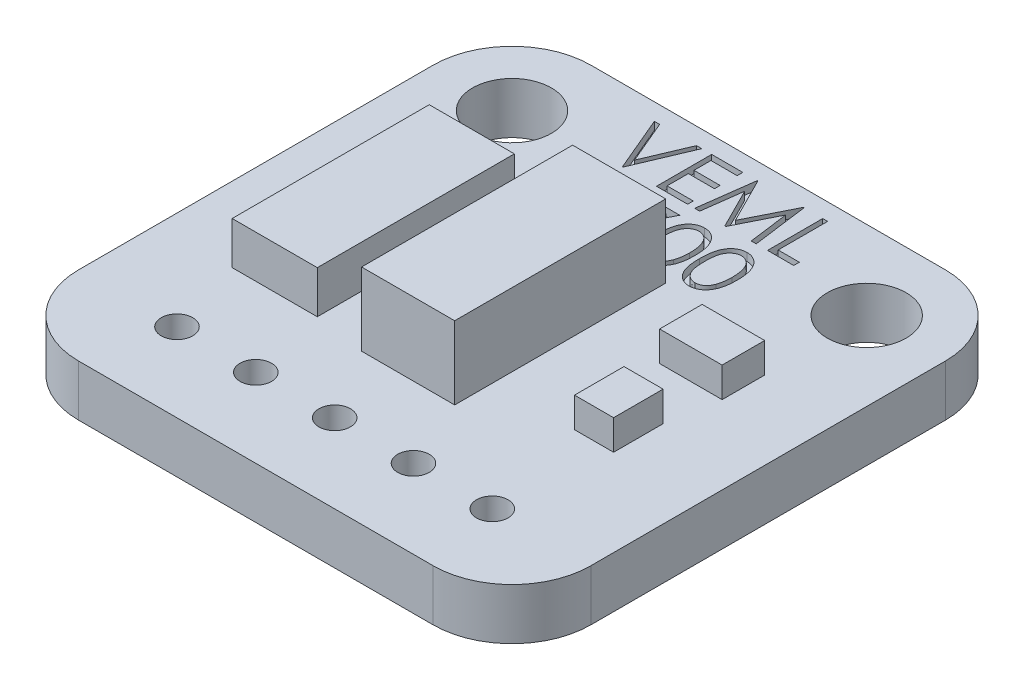
from build123d import *

# Parameters (mm, degrees)
SKETCH1_W             = 16.51
SKETCH1_H             = 16.51
BOSS_EXTRUDE1_DEPTH   = 1.651
SKETCH2_R             = 1.27
CUT_EXTRUDE1_DEPTH    = 12.790498336
FILLET1_R             = 2.54
SKETCH3_W             = 3
SKETCH3_H             = 6.8
BOSS_EXTRUDE2_DEPTH   = 2.35
SKETCH4_R             = 0.508
CUT_EXTRUDE2_DEPTH    = 12.908507463
LPATTERN1_COUNT       = 3
LPATTERN1_PITCH       = 2.54
LPATTERN1_COL_COUNT   = 3
LPATTERN1_COL_PITCH   = 2.54
CUT_EXTRUDE3_DEPTH    = 0.254
SKETCH6_W             = 2.7432
SKETCH6_H             = 6.35
BOSS_EXTRUDE3_DEPTH   = 1.3716
SKETCH6_W_2           = 2.014448681
SKETCH6_H_2           = 1.370944242
BOSS_EXTRUDE3_2_DEPTH = 1.3716
SKETCH6_W_3           = 1.259030426
SKETCH6_H_3           = 1.594771872
BOSS_EXTRUDE3_3_DEPTH = 1.3716
SKETCH7_W             = 3.357414469
SKETCH7_H             = 5.427820057
CUT_EXTRUDE4_DEPTH    = 0.4064
SKETCH8_W             = 2.548569118
SKETCH8_H             = 5.740755426
BOSS_EXTRUDE4_DEPTH   = 0.762
SKETCH9_W             = 0.762
SKETCH9_H             = 0.762
BOSS_EXTRUDE5_DEPTH   = 0.508


with BuildPart() as part:
    # Sketch1 → Boss-Extrude1 (new body)
    with BuildSketch(Plane(origin=(0, 0, 0), x_dir=(1, 0, 0), z_dir=(0, 1, 0))):
        Rectangle(SKETCH1_W, SKETCH1_H)
    extrude(amount=BOSS_EXTRUDE1_DEPTH)

    # Sketch2 → Cut-Extrude1 (cut, through all)
    with BuildSketch(Plane(origin=(0, 1.651, 0), x_dir=(1, 0, 0), z_dir=(0, 1, 0))):
        with Locations(Location((-5.715, 5.715, 0), (0, 0, 270))):
            Circle(SKETCH2_R)
        with Locations(Location((5.715, 5.715, 0), (0, 0, 270))):
            Circle(SKETCH2_R)
    extrude(amount=-CUT_EXTRUDE1_DEPTH, mode=Mode.SUBTRACT)

    # Fillet1
    fillet1_edges = [part.edges().sort_by_distance(p)[0] for p in [
        (8.255, 0.8255, 8.255),
        (-8.255, 0.8255, 8.255),
        (-8.255, 0.8255, -8.255),
        (8.255, 0.8255, -8.255),
    ]]
    fillet(fillet1_edges, radius=FILLET1_R)

    # Sketch4 → Cut-Extrude2 (cut, through all)
    with BuildSketch(Plane(origin=(0, 1.651, 0), x_dir=(1, 0, 0), z_dir=(0, 1, 0))):
        with Locations(Location((0, -5.715, 0), (0, 0, 270))):
            Circle(SKETCH4_R)
    cut_extrude2 = extrude(amount=-CUT_EXTRUDE2_DEPTH, mode=Mode.SUBTRACT)

    # LPattern1: Cut-Extrude2 ×3
    with Locations(*[(i * LPATTERN1_PITCH, 0, 0) for i in range(1, LPATTERN1_COUNT)]):
        add(cut_extrude2, mode=Mode.SUBTRACT)

    # LPattern1 col: Cut-Extrude2 ×3
    with Locations(*[(-i * LPATTERN1_COL_PITCH, 0, 0) for i in range(1, LPATTERN1_COL_COUNT)]):
        add(cut_extrude2, mode=Mode.SUBTRACT)

    # Sketch5 → Cut-Extrude3 (cut)
    # profile 1 of 8: a face of its own
    with BuildSketch(Plane(origin=(0, 1.651, 0), x_dir=(1, 0, 0), z_dir=(0, 1, 0))):
        Polygon((-3.122897436, 7.709835685), (-2.951935897, 7.709835685), (-2.359269231, 6.308663409), (-1.766602564, 7.709835685), (-1.595641026, 7.709835685), (-2.347871795, 5.931835685), (-2.370666667, 5.931835685), align=None)
    # profile 2 of 8: a face of its own
    with BuildSketch(Plane(origin=(0, 1.651, 0), x_dir=(1, 0, 0), z_dir=(0, 1, 0))):
        Polygon((-1.276512821, 7.709835685), (-0.273538462, 7.709835685), (-0.273538462, 7.52747671), (-1.116948718, 7.52747671), (-1.116948718, 6.980399787), (-0.273538462, 6.980399787), (-0.273538462, 6.798040813), (-1.116948718, 6.798040813), (-1.116948718, 6.114194659), (-0.273538462, 6.114194659), (-0.273538462, 5.931835685), (-1.276512821, 5.931835685), align=None)
    # profile 3 of 8: a face of its own
    with BuildSketch(Plane(origin=(0, 1.651, 0), x_dir=(1, 0, 0), z_dir=(0, 1, 0))):
        Polygon((-0.045589744, 5.931835685), (0.189126202, 7.709835685), (0.211921074, 7.709835685), (0.945987179, 6.25096389), (1.678272436, 7.709835685), (1.701423478, 7.709835685), (1.937564103, 5.931835685), (1.77728766, 5.931835685), (1.607038462, 7.211197864), (0.965220353, 5.931835685), (0.929247196, 5.931835685), (0.284935897, 7.214047223), (0.115042869, 5.931835685), align=None)
    # profile 4 of 8: a face of its own
    with BuildSketch(Plane(origin=(0, 1.651, 0), x_dir=(1, 0, 0), z_dir=(0, 1, 0))):
        Polygon((2.302282051, 7.709835685), (2.461846154, 7.709835685), (2.461846154, 6.114194659), (3.145692308, 6.114194659), (3.145692308, 5.931835685), (2.302282051, 5.931835685), align=None)
    # profile 5 of 8: a face of its own
    with BuildSketch(Plane(origin=(0, 1.651, 0), x_dir=(1, 0, 0), z_dir=(0, 1, 0))):
        Polygon((-2.553025641, 5.498301957), (-1.458871795, 5.498301957), (-2.393461538, 3.674712213), (-2.531299279, 3.750576396), (-1.728848558, 5.315942983), (-2.553025641, 5.315942983), align=None)
    # profile 6 of 8: a face of its own
    with BuildSketch(Plane(origin=(0, 1.651, 0), x_dir=(1, 0, 0), z_dir=(0, 1, 0))):
        Polygon((-1.185333333, 5.498301957), (-0.091179487, 5.498301957), (-1.025769231, 3.674712213), (-1.163606971, 3.750576396), (-0.36115625, 5.315942983), (-1.185333333, 5.315942983), align=None)
    # profile 7 of 8: a face of its own
    with BuildSketch(Plane(origin=(0, 1.651, 0), x_dir=(1, 0, 0), z_dir=(0, 1, 0))):
        with BuildLine():
            add(Edge.make_bspline(
                [(0.068384615, 4.608589617), (0.068551249, 4.63708709), (0.068874936, 4.692443842), (0.072475854, 4.77310644), (0.078457728, 4.848778267), (0.086655513, 4.919462945), (0.096631607, 4.985178721), (0.109949074, 5.045749978), (0.125093978, 5.101457058), (0.142646621, 5.152481618), (0.162452417, 5.199511092), (0.184009022, 5.243415094), (0.208171937, 5.284127196), (0.233560209, 5.322297193), (0.261201542, 5.35730027), (0.290309327, 5.389630743), (0.32201964, 5.418541404), (0.355254528, 5.444879325), (0.390314892, 5.467967657), (0.426201367, 5.488304288), (0.463160961, 5.505677821), (0.501294581, 5.519338162), (0.540259481, 5.530621272), (0.580191871, 5.538337258), (0.621157684, 5.543192167), (0.648808852, 5.543656311), (0.662832131, 5.543891701)],
                knots=[0, 0, 0, 0, 1.646270934, 3.197905019, 4.663502075, 6.030701355, 7.308322542, 8.50163776, 9.611534131, 10.641858119, 11.616356847, 12.558055219, 13.465016945, 14.349605745, 15.204443733, 16.039544428, 16.859896111, 17.680448484, 18.487036065, 19.28249412, 20.06191084, 20.843045899, 21.620316918, 22.403196591, 23.190181807, 24, 24, 24, 24], degree=3))
            add(Edge.make_bspline(
                [(0.662832131, 5.543891701), (0.676972554, 5.54364389), (0.705093407, 5.543151074), (0.746668318, 5.538414511), (0.787282756, 5.530555181), (0.82676357, 5.519419326), (0.865435064, 5.505603922), (0.902994759, 5.488287666), (0.939675956, 5.468130802), (0.974895742, 5.444445872), (1.009040767, 5.418038876), (1.041272332, 5.38818744), (1.071593372, 5.355192983), (1.100384427, 5.319408516), (1.12682867, 5.280147693), (1.152011974, 5.238093365), (1.174552968, 5.192510086), (1.196262183, 5.144158408), (1.215000772, 5.091700469), (1.231900025, 5.035431971), (1.245554541, 4.974688284), (1.256928291, 4.909788111), (1.265739498, 4.84049311), (1.27215688, 4.766951822), (1.275546808, 4.689115863), (1.276185212, 4.635898876), (1.276512821, 4.608589617)],
                knots=[0, 0, 0, 0, 0.810914788, 1.612654377, 2.396697861, 3.181598691, 3.963628158, 4.749916497, 5.551656086, 6.361998678, 7.18212741, 8.025565596, 8.878627764, 9.750805457, 10.657531673, 11.591944965, 12.560506719, 13.57287815, 14.630710178, 15.753379473, 16.941251878, 18.199788006, 19.531962791, 20.947069417, 22.433333509, 24, 24, 24, 24], degree=3))
            add(Edge.make_bspline(
                [(1.276512821, 4.608589617), (1.276181816, 4.581399472), (1.275536866, 4.528420583), (1.272194883, 4.450934847), (1.265611898, 4.377783841), (1.257377224, 4.308792126), (1.245972135, 4.244246856), (1.231948711, 4.183924676), (1.216378347, 4.127565088), (1.197158271, 4.075629804), (1.17612163, 4.027394328), (1.153233591, 3.982351417), (1.128712519, 3.94010294), (1.101997437, 3.900987069), (1.073522303, 3.864726711), (1.042677666, 3.831961919), (1.010333009, 3.801903217), (0.976087501, 3.775156191), (0.940318433, 3.75174511), (0.903763222, 3.730808474), (0.865773264, 3.713926265), (0.827209484, 3.699430464), (0.787520274, 3.688355834), (0.746755107, 3.680698316), (0.705121339, 3.675327817), (0.676977344, 3.674918125), (0.662832131, 3.674712213)],
                knots=[0, 0, 0, 0, 1.561518951, 3.042555995, 4.452378317, 5.7783523, 7.031515105, 8.214008947, 9.334062868, 10.386615937, 11.391082383, 12.354592575, 13.286541444, 14.194233754, 15.072674879, 15.931287219, 16.775624067, 17.606195743, 18.42308326, 19.229000347, 20.022332153, 20.807536673, 21.593273796, 22.3848459, 23.188221202, 24, 24, 24, 24], degree=3))
            add(Edge.make_bspline(
                [(0.662832131, 3.674712213), (0.648809242, 3.674949122), (0.62115884, 3.675416259), (0.580187408, 3.680249235), (0.540419926, 3.688019351), (0.501660159, 3.698898986), (0.46370925, 3.712216122), (0.427084336, 3.729566194), (0.391378193, 3.749547901), (0.356686082, 3.772303975), (0.323659904, 3.79837539), (0.292113813, 3.827211648), (0.262840303, 3.859532341), (0.235594183, 3.894827126), (0.209699346, 3.932771293), (0.185879544, 3.973882907), (0.16384715, 4.017998953), (0.143708257, 4.065404452), (0.125852736, 4.116791155), (0.1100805, 4.172746938), (0.097627308, 4.233765681), (0.086967967, 4.299357303), (0.07837038, 4.36980366), (0.072500783, 4.445142995), (0.068872995, 4.525328361), (0.068550379, 4.580329407), (0.068384615, 4.608589617)],
                knots=[0, 0, 0, 0, 0.810891512, 1.598919785, 2.382837074, 3.152667961, 3.926044502, 4.706494248, 5.493654104, 6.291793342, 7.103789334, 7.925228297, 8.761435821, 9.622817696, 10.50288917, 11.416980706, 12.369136599, 13.353924996, 14.394355917, 15.514179734, 16.714354668, 17.994756427, 19.357759367, 20.818452758, 22.365282078, 24, 24, 24, 24], degree=3))
        make_face()
        with BuildLine():
            add(Edge.make_bspline(
                [(0.227948718, 4.609301957), (0.228009397, 4.585553618), (0.228127163, 4.539462755), (0.231203713, 4.472486379), (0.235394831, 4.410017452), (0.24080061, 4.351976655), (0.248828508, 4.298560449), (0.257823556, 4.24940145), (0.268769986, 4.204759813), (0.281721455, 4.164329205), (0.296473316, 4.127423479), (0.312579895, 4.093082061), (0.329882742, 4.060899278), (0.34924727, 4.031164205), (0.370336922, 4.003779873), (0.392675338, 3.978261594), (0.417096211, 3.955504728), (0.450880112, 3.928211486), (0.495480721, 3.900007766), (0.551675912, 3.875447952), (0.609419485, 3.860013664), (0.648612321, 3.858050876), (0.668174679, 3.857071188)],
                knots=[0, 0, 0, 0, 1.459021318, 2.831673884, 4.118529203, 5.306027144, 6.411944654, 7.436330062, 8.375795394, 9.233974572, 10.042671642, 10.816086306, 11.563610507, 12.285937304, 12.993564865, 13.685989202, 14.367179055, 15.041617293, 16.353048772, 17.594441528, 18.799311195, 20, 20, 20, 20], degree=3))
            add(Edge.make_bspline(
                [(0.668174679, 3.857071188), (0.687863577, 3.85788286), (0.727200721, 3.85950453), (0.784672689, 3.875150288), (0.840466466, 3.898756815), (0.884191012, 3.926670147), (0.917456144, 3.953252939), (0.941289975, 3.97591718), (0.963165495, 4.001294761), (0.983913269, 4.028675603), (1.00294248, 4.058582825), (1.020246554, 4.090872613), (1.036036894, 4.125634635), (1.04503309, 4.149901663), (1.049632612, 4.162308768)],
                knots=[0, 0, 0, 0, 1.353760809, 2.704726607, 4.075137775, 5.516104923, 6.260822281, 7.007110065, 7.778089737, 8.566572457, 9.372053459, 10.217411131, 11.088608312, 12, 12, 12, 12], degree=3))
            add(Edge.make_bspline(
                [(1.049632612, 4.162308768), (1.05499291, 4.178173476), (1.065876614, 4.210385636), (1.079903395, 4.260354371), (1.090950058, 4.312781375), (1.100888248, 4.367353334), (1.1076716, 4.424472702), (1.11313149, 4.483962746), (1.116347478, 4.545868318), (1.116746132, 4.587928173), (1.116948718, 4.609301957)],
                knots=[0, 0, 0, 0, 0.884706709, 1.796334032, 2.740027952, 3.714592787, 4.726048262, 5.777819803, 6.87074269, 8, 8, 8, 8], degree=3))
            add(Edge.make_bspline(
                [(1.116948718, 4.609301957), (1.116669222, 4.630672284), (1.116122468, 4.672477212), (1.114032562, 4.733700447), (1.108635786, 4.79185007), (1.102641834, 4.84717659), (1.093804045, 4.899373744), (1.084275079, 4.948878499), (1.071472864, 4.995077555), (1.057797618, 5.038694223), (1.042145937, 5.079232955), (1.024916744, 5.116882759), (1.006516091, 5.151825399), (0.986530232, 5.183965005), (0.965196425, 5.213445537), (0.94195159, 5.239675911), (0.917717769, 5.263469091), (0.883774639, 5.290628076), (0.839337699, 5.318320017), (0.784044111, 5.343804223), (0.726502623, 5.358438836), (0.687603309, 5.360502173), (0.668174679, 5.361532726)],
                knots=[0, 0, 0, 0, 1.31362396, 2.569729283, 3.763502607, 4.902122613, 5.988968491, 7.01645872, 7.998833611, 8.933434873, 9.825090667, 10.667526885, 11.477055099, 12.250526234, 12.991942729, 13.710640831, 14.402115721, 15.076753259, 16.378508321, 17.609869233, 18.806226677, 20, 20, 20, 20], degree=3))
            add(Edge.make_bspline(
                [(0.668174679, 5.361532726), (0.648509699, 5.360500751), (0.609143912, 5.358434921), (0.551004351, 5.343858749), (0.495274541, 5.318452162), (0.450955109, 5.290536357), (0.416988306, 5.263948495), (0.393070298, 5.240892176), (0.370644042, 5.215671879), (0.349984851, 5.188035706), (0.330635495, 5.158335299), (0.31286514, 5.126337007), (0.296854337, 5.091878674), (0.282079392, 5.054989525), (0.269088416, 5.014562405), (0.258372683, 4.969975756), (0.24847326, 4.920973115), (0.241465263, 4.867267605), (0.235235275, 4.809212271), (0.231231551, 4.746587393), (0.228116872, 4.679498688), (0.228005892, 4.633169516), (0.227948718, 4.609301957)],
                knots=[0, 0, 0, 0, 1.207732386, 2.417664972, 3.655092373, 4.956220595, 5.625982001, 6.301752483, 6.994047911, 7.697131622, 8.419323945, 9.170223765, 9.943494443, 10.752040957, 11.610060368, 12.549350801, 13.567764191, 14.679664412, 15.874934091, 17.154273443, 18.533957287, 20, 20, 20, 20], degree=3))
        make_face(mode=Mode.SUBTRACT)
    # profile 8 of 8: a face of its own
    with BuildSketch(Plane(origin=(0, 1.651, 0), x_dir=(1, 0, 0), z_dir=(0, 1, 0))):
        with BuildLine():
            add(Edge.make_bspline(
                [(1.436076923, 4.608589617), (1.436243556, 4.63708709), (1.436567244, 4.692443842), (1.440168162, 4.77310644), (1.446150035, 4.848778267), (1.454347821, 4.919462945), (1.464323915, 4.985178721), (1.477641382, 5.045749978), (1.492786286, 5.101457058), (1.510338928, 5.152481618), (1.530144725, 5.199511092), (1.551701329, 5.243415094), (1.575864245, 5.284127196), (1.601252517, 5.322297193), (1.628893849, 5.35730027), (1.658001635, 5.389630743), (1.689711948, 5.418541404), (1.722946836, 5.444879325), (1.7580072, 5.467967657), (1.793893674, 5.488304288), (1.830853268, 5.505677821), (1.868986889, 5.519338162), (1.907951789, 5.530621272), (1.947884178, 5.538337258), (1.988849991, 5.543192167), (2.01650116, 5.543656311), (2.030524439, 5.543891701)],
                knots=[0, 0, 0, 0, 1.646270934, 3.197905019, 4.663502075, 6.030701355, 7.308322542, 8.50163776, 9.611534131, 10.641858119, 11.616356847, 12.558055219, 13.465016945, 14.349605745, 15.204443733, 16.039544428, 16.859896111, 17.680448484, 18.487036065, 19.28249412, 20.06191084, 20.843045899, 21.620316918, 22.403196591, 23.190181807, 24, 24, 24, 24], degree=3))
            add(Edge.make_bspline(
                [(2.030524439, 5.543891701), (2.044664862, 5.54364389), (2.072785715, 5.543151074), (2.114360625, 5.538414511), (2.154975064, 5.530555181), (2.194455878, 5.519419326), (2.233127371, 5.505603922), (2.270687066, 5.488287666), (2.307368264, 5.468130802), (2.34258805, 5.444445872), (2.376733074, 5.418038876), (2.40896464, 5.38818744), (2.439285679, 5.355192983), (2.468076734, 5.319408516), (2.494520978, 5.280147693), (2.519704281, 5.238093365), (2.542245276, 5.192510086), (2.563954491, 5.144158408), (2.58269308, 5.091700469), (2.599592332, 5.035431971), (2.613246848, 4.974688284), (2.624620599, 4.909788111), (2.633431806, 4.84049311), (2.639849188, 4.766951822), (2.643239115, 4.689115863), (2.64387752, 4.635898876), (2.644205128, 4.608589617)],
                knots=[0, 0, 0, 0, 0.810914788, 1.612654377, 2.396697861, 3.181598691, 3.963628158, 4.749916497, 5.551656086, 6.361998678, 7.18212741, 8.025565596, 8.878627764, 9.750805457, 10.657531673, 11.591944965, 12.560506719, 13.57287815, 14.630710178, 15.753379473, 16.941251878, 18.199788006, 19.531962791, 20.947069417, 22.433333509, 24, 24, 24, 24], degree=3))
            add(Edge.make_bspline(
                [(2.644205128, 4.608589617), (2.643874123, 4.581399472), (2.643229174, 4.528420583), (2.639887191, 4.450934847), (2.633304206, 4.377783841), (2.625069532, 4.308792126), (2.613664443, 4.244246856), (2.599641018, 4.183924676), (2.584070654, 4.127565088), (2.564850579, 4.075629804), (2.543813938, 4.027394328), (2.520925898, 3.982351417), (2.496404827, 3.94010294), (2.469689744, 3.900987069), (2.44121461, 3.864726711), (2.410369974, 3.831961919), (2.378025316, 3.801903217), (2.343779809, 3.775156191), (2.308010741, 3.75174511), (2.27145553, 3.730808474), (2.233465571, 3.713926265), (2.194901791, 3.699430464), (2.155212581, 3.688355834), (2.114447415, 3.680698316), (2.072813647, 3.675327817), (2.044669652, 3.674918125), (2.030524439, 3.674712213)],
                knots=[0, 0, 0, 0, 1.561518951, 3.042555995, 4.452378317, 5.7783523, 7.031515105, 8.214008947, 9.334062868, 10.386615937, 11.391082383, 12.354592575, 13.286541444, 14.194233754, 15.072674879, 15.931287219, 16.775624067, 17.606195743, 18.42308326, 19.229000347, 20.022332153, 20.807536673, 21.593273796, 22.3848459, 23.188221202, 24, 24, 24, 24], degree=3))
            add(Edge.make_bspline(
                [(2.030524439, 3.674712213), (2.016501549, 3.674949122), (1.988851147, 3.675416259), (1.947879715, 3.680249235), (1.908112234, 3.688019351), (1.869352467, 3.698898986), (1.831401557, 3.712216122), (1.794776644, 3.729566194), (1.7590705, 3.749547901), (1.72437839, 3.772303975), (1.691352212, 3.79837539), (1.659806121, 3.827211648), (1.630532611, 3.859532341), (1.60328649, 3.894827126), (1.577391654, 3.932771293), (1.553571852, 3.973882907), (1.531539458, 4.017998953), (1.511400565, 4.065404452), (1.493545044, 4.116791155), (1.477772808, 4.172746938), (1.465319616, 4.233765681), (1.454660275, 4.299357303), (1.446062688, 4.36980366), (1.440193091, 4.445142995), (1.436565303, 4.525328361), (1.436242687, 4.580329407), (1.436076923, 4.608589617)],
                knots=[0, 0, 0, 0, 0.810891512, 1.598919785, 2.382837074, 3.152667961, 3.926044502, 4.706494248, 5.493654104, 6.291793342, 7.103789334, 7.925228297, 8.761435821, 9.622817696, 10.50288917, 11.416980706, 12.369136599, 13.353924996, 14.394355917, 15.514179734, 16.714354668, 17.994756427, 19.357759367, 20.818452758, 22.365282078, 24, 24, 24, 24], degree=3))
        make_face()
        with BuildLine():
            add(Edge.make_bspline(
                [(1.595641026, 4.609301957), (1.595701705, 4.585553618), (1.595819471, 4.539462755), (1.598896021, 4.472486379), (1.603087139, 4.410017452), (1.608492918, 4.351976655), (1.616520816, 4.298560449), (1.625515864, 4.24940145), (1.636462293, 4.204759813), (1.649413762, 4.164329205), (1.664165624, 4.127423479), (1.680272202, 4.093082061), (1.69757505, 4.060899278), (1.716939578, 4.031164205), (1.73802923, 4.003779873), (1.760367646, 3.978261594), (1.784788519, 3.955504728), (1.81857242, 3.928211486), (1.863173029, 3.900007766), (1.91936822, 3.875447952), (1.977111793, 3.860013664), (2.016304628, 3.858050876), (2.035866987, 3.857071188)],
                knots=[0, 0, 0, 0, 1.459021318, 2.831673884, 4.118529203, 5.306027144, 6.411944654, 7.436330062, 8.375795394, 9.233974572, 10.042671642, 10.816086306, 11.563610507, 12.285937304, 12.993564865, 13.685989202, 14.367179055, 15.041617293, 16.353048772, 17.594441528, 18.799311195, 20, 20, 20, 20], degree=3))
            add(Edge.make_bspline(
                [(2.035866987, 3.857071188), (2.055555884, 3.85788286), (2.094893029, 3.85950453), (2.152364996, 3.875150288), (2.208158774, 3.898756815), (2.251883319, 3.926670147), (2.285148451, 3.953252939), (2.308982282, 3.97591718), (2.330857803, 4.001294761), (2.351605577, 4.028675603), (2.370634788, 4.058582825), (2.387938861, 4.090872613), (2.403729202, 4.125634635), (2.412725397, 4.149901663), (2.41732492, 4.162308768)],
                knots=[0, 0, 0, 0, 1.353760809, 2.704726607, 4.075137775, 5.516104923, 6.260822281, 7.007110065, 7.778089737, 8.566572457, 9.372053459, 10.217411131, 11.088608312, 12, 12, 12, 12], degree=3))
            add(Edge.make_bspline(
                [(2.41732492, 4.162308768), (2.422685218, 4.178173476), (2.433568922, 4.210385636), (2.447595703, 4.260354371), (2.458642366, 4.312781375), (2.468580556, 4.367353334), (2.475363908, 4.424472702), (2.480823797, 4.483962746), (2.484039786, 4.545868318), (2.48443844, 4.587928173), (2.484641026, 4.609301957)],
                knots=[0, 0, 0, 0, 0.884706709, 1.796334032, 2.740027952, 3.714592787, 4.726048262, 5.777819803, 6.87074269, 8, 8, 8, 8], degree=3))
            add(Edge.make_bspline(
                [(2.484641026, 4.609301957), (2.48436153, 4.630672284), (2.483814775, 4.672477212), (2.48172487, 4.733700447), (2.476328094, 4.79185007), (2.470334141, 4.84717659), (2.461496353, 4.899373744), (2.451967387, 4.948878499), (2.439165171, 4.995077555), (2.425489926, 5.038694223), (2.409838245, 5.079232955), (2.392609052, 5.116882759), (2.374208398, 5.151825399), (2.35422254, 5.183965005), (2.332888733, 5.213445537), (2.309643898, 5.239675911), (2.285410077, 5.263469091), (2.251466946, 5.290628076), (2.207030007, 5.318320017), (2.151736418, 5.343804223), (2.094194931, 5.358438836), (2.055295616, 5.360502173), (2.035866987, 5.361532726)],
                knots=[0, 0, 0, 0, 1.31362396, 2.569729283, 3.763502607, 4.902122613, 5.988968491, 7.01645872, 7.998833611, 8.933434873, 9.825090667, 10.667526885, 11.477055099, 12.250526234, 12.991942729, 13.710640831, 14.402115721, 15.076753259, 16.378508321, 17.609869233, 18.806226677, 20, 20, 20, 20], degree=3))
            add(Edge.make_bspline(
                [(2.035866987, 5.361532726), (2.016202006, 5.360500751), (1.97683622, 5.358434921), (1.918696659, 5.343858749), (1.862966848, 5.318452162), (1.818647417, 5.290536357), (1.784680614, 5.263948495), (1.760762605, 5.240892176), (1.73833635, 5.215671879), (1.717677158, 5.188035706), (1.698327802, 5.158335299), (1.680557448, 5.126337007), (1.664546645, 5.091878674), (1.6497717, 5.054989525), (1.636780724, 5.014562405), (1.62606499, 4.969975756), (1.616165568, 4.920973115), (1.609157571, 4.867267605), (1.602927583, 4.809212271), (1.598923858, 4.746587393), (1.595809179, 4.679498688), (1.5956982, 4.633169516), (1.595641026, 4.609301957)],
                knots=[0, 0, 0, 0, 1.207732386, 2.417664972, 3.655092373, 4.956220595, 5.625982001, 6.301752483, 6.994047911, 7.697131622, 8.419323945, 9.170223765, 9.943494443, 10.752040957, 11.610060368, 12.549350801, 13.567764191, 14.679664412, 15.874934091, 17.154273443, 18.533957287, 20, 20, 20, 20], degree=3))
        make_face(mode=Mode.SUBTRACT)
    extrude(amount=-CUT_EXTRUDE3_DEPTH, mode=Mode.SUBTRACT)


with BuildPart() as body_2:
    # Sketch3 → Boss-Extrude2 (new body)
    with BuildSketch(Plane(origin=(0, 1.651, 0), x_dir=(1, 0, 0), z_dir=(0, 1, 0))):
        with Locations((0.0748, -0.0218)):
            Rectangle(SKETCH3_W, SKETCH3_H)
    extrude(amount=BOSS_EXTRUDE2_DEPTH)


with BuildPart() as body_3:
    # Sketch6 → Boss-Extrude3 (new body)
    with BuildSketch(Plane(origin=(0, 1.651, 0), x_dir=(1, 0, 0), z_dir=(0, 1, 0))):
        with Locations((-4.4704, 0)):
            Rectangle(SKETCH6_W, SKETCH6_H)
    extrude(amount=BOSS_EXTRUDE3_DEPTH)


with BuildPart() as body_4:
    # Sketch6 → Boss-Extrude3 2 (new body)
    with BuildSketch(Plane(origin=(0, 1.651, 0), x_dir=(1, 0, 0), z_dir=(0, 1, 0))):
        with Locations((4.72835871, 1.720674915)):
            Rectangle(SKETCH6_W_2, SKETCH6_H_2)
    extrude(amount=BOSS_EXTRUDE3_2_DEPTH)


with BuildPart() as body_5:
    # Sketch6 → Boss-Extrude3 3 (new body)
    with BuildSketch(Plane(origin=(0, 1.651, 0), x_dir=(1, 0, 0), z_dir=(0, 1, 0))):
        with Locations((4.826283298, -1.384933468)):
            Rectangle(SKETCH6_W_3, SKETCH6_H_3)
    extrude(amount=BOSS_EXTRUDE3_3_DEPTH)


with BuildPart() as cut_extrude4_tool:
    # Sketch7 → Cut-Extrude4 (new body)
    with BuildSketch(Plane(origin=(0, 3.0226, 0), x_dir=(1, 0, 0), z_dir=(0, 1, 0))):
        with Locations((4.812294072, 0.083935361)):
            Rectangle(SKETCH7_W, SKETCH7_H)
    extrude(amount=-CUT_EXTRUDE4_DEPTH)


with BuildPart() as body_4_1:
    add(body_4.part)

    # Cut-Extrude4: cut by cut_extrude4_tool
    add(cut_extrude4_tool.part, mode=Mode.SUBTRACT)


with BuildPart() as body_5_1:
    add(body_5.part)

    # Cut-Extrude4: cut by cut_extrude4_tool
    add(cut_extrude4_tool.part, mode=Mode.SUBTRACT)


with BuildPart() as body_6:
    # Sketch8 → Boss-Extrude4 (new body)
    with BuildSketch(Plane(origin=(0, 1.651, 0), x_dir=(1, 0, 0), z_dir=(0, 1, 0))):
        Rectangle(SKETCH8_W, SKETCH8_H)
    extrude(amount=BOSS_EXTRUDE4_DEPTH)


with BuildPart() as body_7:
    # Sketch9 → Boss-Extrude5 (new body)
    with BuildSketch(Plane(origin=(0, 2.413, 0), x_dir=(1, 0, 0), z_dir=(0, 1, 0))):
        with Locations((0.639284559, 0)):
            Rectangle(SKETCH9_W, SKETCH9_H)
    extrude(amount=BOSS_EXTRUDE5_DEPTH)


solid = Compound([part.part, body_2.part, body_3.part, body_4_1.part, body_5_1.part, body_6.part, body_7.part])
